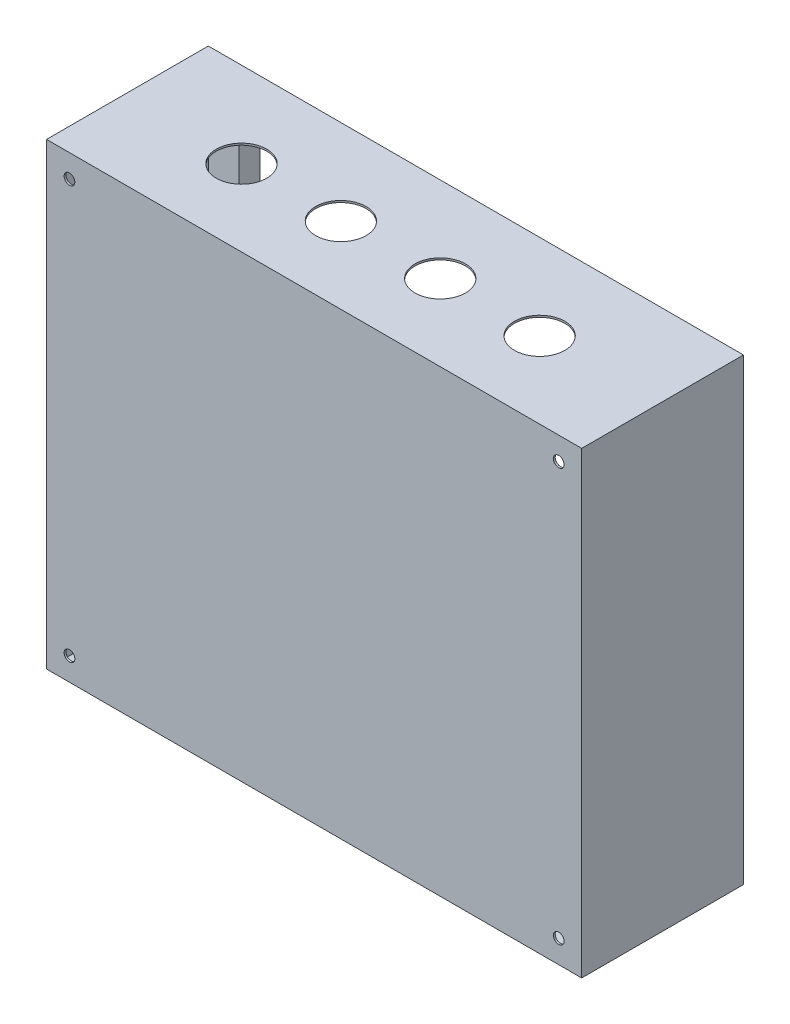
from build123d import *

# Parameters (mm, degrees)
SKETCH_1_W          = 350
SKETCH_1_H          = 300
EXTRUDE_1_DEPTH     = 52.9
SKETCH_2_W          = 310
SKETCH_2_H          = 260
EXTRUDE_2_DEPTH     = 12
SKETCH_6_W          = 310
SKETCH_6_H          = 260
EXTRUDE_3_DEPTH     = 4
EXTRUDE_3_DRAFT     = -45
SHELL_1_T           = -1.2
CUT_EXTRUDE_3_REACH = 262.692
SKETCH_12_R         = 3.5
CUT_EXTRUDE_4_REACH = 356.079
SKETCH_13_R         = 16.5


with BuildPart() as part:
    # 草图1 → 凸台-拉伸1 (new, symmetric)
    with BuildSketch(Plane.XY):
        Rectangle(SKETCH_1_W, SKETCH_1_H)
    extrude(amount=EXTRUDE_1_DEPTH, both=True)

    # 草图2 → 凸台-拉伸2 (add)
    with BuildSketch(Plane(origin=(0, 0, -52.9), x_dir=(-1, 0, 0), z_dir=(0, 0, -1))):
        Rectangle(SKETCH_2_W, SKETCH_2_H)
    extrude(amount=EXTRUDE_2_DEPTH)


with BuildPart() as extrude_3_tool:
    # 草图6 → 凸台-拉伸3 (with draft: the straight prism first)
    with BuildSketch(Plane(origin=(0, 0, -64.9), x_dir=(-1, 0, 0), z_dir=(0, 0, -1))):
        Rectangle(SKETCH_6_W, SKETCH_6_H)
    extrude(amount=EXTRUDE_3_DEPTH)
    # 凸台-拉伸3: the draft: its side faces are tilted about the plane it starts from
    extrude_3_sides = [extrude_3_tool.faces().sort_by_distance(p)[0] for p in [
        (155, 0, -66.9),
        (0, -130, -66.9),
        (-155, 0, -66.9),
        (0, 130, -66.9),
    ]]
    draft(extrude_3_sides, Plane(origin=(0, 0, -64.9), x_dir=(-1, 0, 0), z_dir=(0, 0, -1)), EXTRUDE_3_DRAFT)


with BuildPart() as part_1:
    add(part.part)

    # 凸台-拉伸3: add extrude_3_tool
    add(extrude_3_tool.part)

    # 抽壳1
    shell_1_openings = [part_1.faces().sort_by_distance(p)[0] for p in [
        (0, 0, -68.9),
    ]]
    offset(amount=SHELL_1_T, openings=shell_1_openings, kind=Kind.INTERSECTION)

    # 草图12 → 切除-拉伸3 (cut, up to next)
    with BuildSketch(Plane.XY.offset(52.9), mode=Mode.PRIVATE) as cut_extrude_3_sk1:
        with Locations((-160, 135)):
            Circle(SKETCH_12_R)
    cut_extrude_3_tool1 = extrude(cut_extrude_3_sk1.sketch, amount=-CUT_EXTRUDE_3_REACH, mode=Mode.PRIVATE) & part_1.part
    # 草图12 → 切除-拉伸3 (cut, up to next)
    with BuildSketch(Plane.XY.offset(52.9), mode=Mode.PRIVATE) as cut_extrude_3_sk2:
        with Locations((160, 135)):
            Circle(SKETCH_12_R)
    cut_extrude_3_tool2 = extrude(cut_extrude_3_sk2.sketch, amount=-CUT_EXTRUDE_3_REACH, mode=Mode.PRIVATE) & part_1.part
    # 草图12 → 切除-拉伸3 (cut, up to next)
    with BuildSketch(Plane.XY.offset(52.9), mode=Mode.PRIVATE) as cut_extrude_3_sk3:
        with Locations((160, -135)):
            Circle(SKETCH_12_R)
    cut_extrude_3_tool3 = extrude(cut_extrude_3_sk3.sketch, amount=-CUT_EXTRUDE_3_REACH, mode=Mode.PRIVATE) & part_1.part
    # 草图12 → 切除-拉伸3 (cut, up to next)
    with BuildSketch(Plane.XY.offset(52.9), mode=Mode.PRIVATE) as cut_extrude_3_sk4:
        with Locations((-160, -135)):
            Circle(SKETCH_12_R)
    cut_extrude_3_tool4 = extrude(cut_extrude_3_sk4.sketch, amount=-CUT_EXTRUDE_3_REACH, mode=Mode.PRIVATE) & part_1.part
    add(cut_extrude_3_tool1.solids().sort_by_distance((-160, 135, 52.9))[0], mode=Mode.SUBTRACT)
    add(cut_extrude_3_tool2.solids().sort_by_distance((160, 135, 52.9))[0], mode=Mode.SUBTRACT)
    add(cut_extrude_3_tool3.solids().sort_by_distance((160, -135, 52.9))[0], mode=Mode.SUBTRACT)
    add(cut_extrude_3_tool4.solids().sort_by_distance((-160, -135, 52.9))[0], mode=Mode.SUBTRACT)

    # 草图13 → 切除-拉伸4 (cut, up to next)
    with BuildSketch(Plane(origin=(0, 150, 0), x_dir=(1, 0, 0), z_dir=(0, 1, 0)), mode=Mode.PRIVATE) as cut_extrude_4_sk1:
        with Locations(Location((-32.5, -2.9, 0), (0, 0, 180))):
            Circle(SKETCH_13_R)
    cut_extrude_4_tool1 = extrude(cut_extrude_4_sk1.sketch, amount=-CUT_EXTRUDE_4_REACH, mode=Mode.PRIVATE) & part_1.part
    # 草图13 → 切除-拉伸4 (cut, up to next)
    with BuildSketch(Plane(origin=(0, 150, 0), x_dir=(1, 0, 0), z_dir=(0, 1, 0)), mode=Mode.PRIVATE) as cut_extrude_4_sk2:
        with Locations(Location((32.5, -2.9, 0), (0, 0, 180))):
            Circle(SKETCH_13_R)
    cut_extrude_4_tool2 = extrude(cut_extrude_4_sk2.sketch, amount=-CUT_EXTRUDE_4_REACH, mode=Mode.PRIVATE) & part_1.part
    # 草图13 → 切除-拉伸4 (cut, up to next)
    with BuildSketch(Plane(origin=(0, 150, 0), x_dir=(1, 0, 0), z_dir=(0, 1, 0)), mode=Mode.PRIVATE) as cut_extrude_4_sk3:
        with Locations(Location((97.5, -2.9, 0), (0, 0, 180))):
            Circle(SKETCH_13_R)
    cut_extrude_4_tool3 = extrude(cut_extrude_4_sk3.sketch, amount=-CUT_EXTRUDE_4_REACH, mode=Mode.PRIVATE) & part_1.part
    # 草图13 → 切除-拉伸4 (cut, up to next)
    with BuildSketch(Plane(origin=(0, 150, 0), x_dir=(1, 0, 0), z_dir=(0, 1, 0)), mode=Mode.PRIVATE) as cut_extrude_4_sk4:
        with Locations(Location((-97.5, -2.9, 0), (0, 0, 180))):
            Circle(SKETCH_13_R)
    cut_extrude_4_tool4 = extrude(cut_extrude_4_sk4.sketch, amount=-CUT_EXTRUDE_4_REACH, mode=Mode.PRIVATE) & part_1.part
    add(cut_extrude_4_tool1.solids().sort_by_distance((-32.5, 150, 2.9))[0], mode=Mode.SUBTRACT)
    add(cut_extrude_4_tool2.solids().sort_by_distance((32.5, 150, 2.9))[0], mode=Mode.SUBTRACT)
    add(cut_extrude_4_tool3.solids().sort_by_distance((97.5, 150, 2.9))[0], mode=Mode.SUBTRACT)
    add(cut_extrude_4_tool4.solids().sort_by_distance((-97.5, 150, 2.9))[0], mode=Mode.SUBTRACT)


solid = part_1.part
